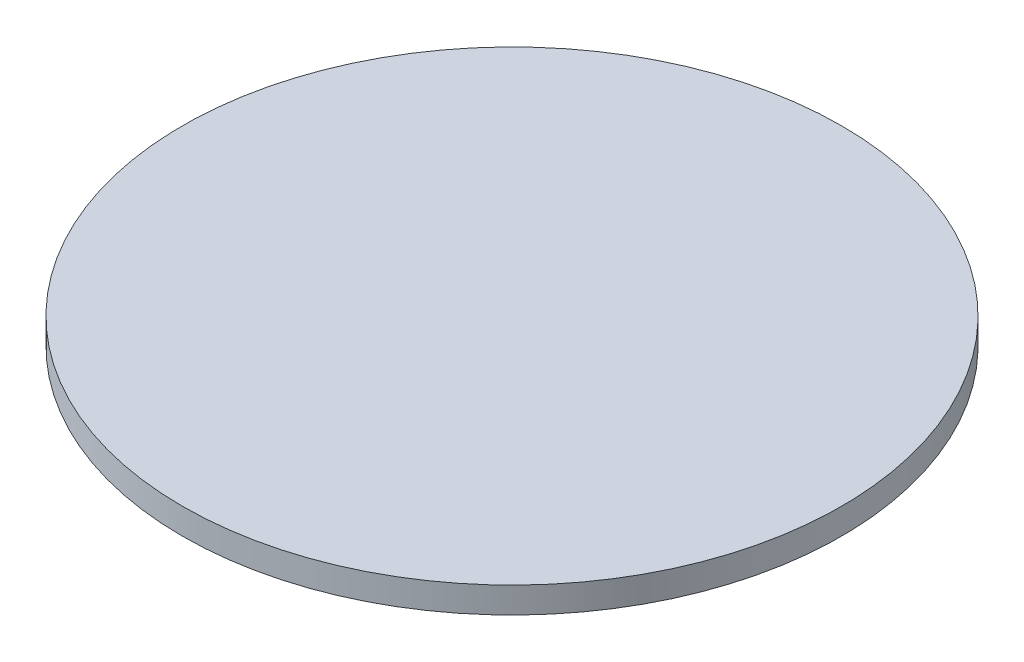
from build123d import *

# Parameters (mm, degrees)
RECONSTRUCTED_NOMINAL_AXIAL_PROFILE_W = 25.4
RECONSTRUCTED_NOMINAL_AXIAL_PROFILE_H = 2


with BuildPart() as part:
    # Reconstructed nominal axial profile → Native revolved geometry (revolve)
    with BuildSketch(Plane.XY, mode=Mode.PRIVATE) as native_revolved_geometry_sk:
        with Locations((12.7, 1)):
            Rectangle(RECONSTRUCTED_NOMINAL_AXIAL_PROFILE_W, RECONSTRUCTED_NOMINAL_AXIAL_PROFILE_H)
    revolve(native_revolved_geometry_sk.sketch.rotate(Axis((0, -500, 0), (0, 1, 0)), 90), axis=Axis((0, -500, 0), (0, 1, 0)))


solid = part.part
